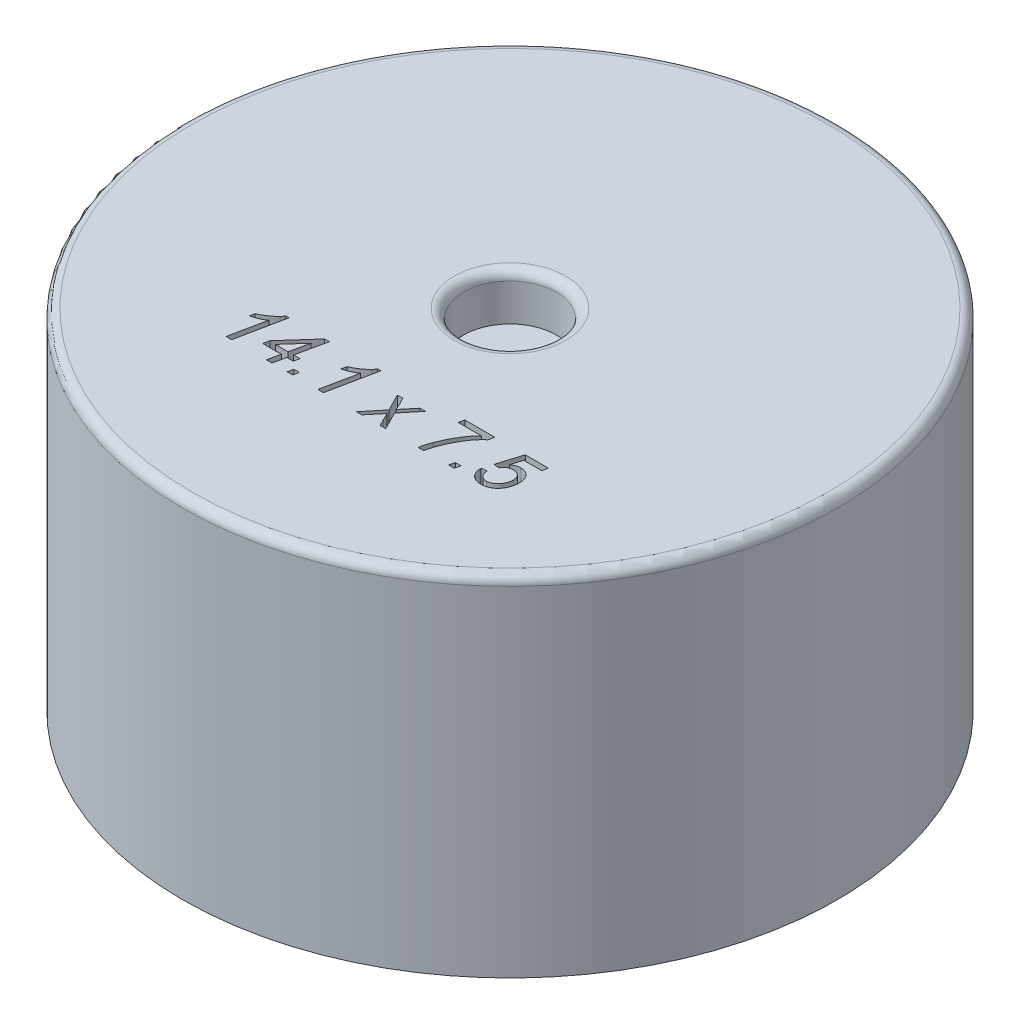
from build123d import *

# Parameters (mm, degrees)
SKETCH_1_R          = 7.05
EXTRUDE_1_DEPTH     = 7.5
FILLET_1_R          = 0.2
SKETCH_2_R          = 1
CUT_EXTRUDE_1_DEPTH = 1
FILLET_2_R          = 0.2
SKETCH_3_R          = 0.35
EXTRUDE_2_DEPTH     = 2
CUT_EXTRUDE_2_DEPTH = 0.5


with BuildPart() as part:
    # Эскиз1 → Бобышка-Вытянуть1 (new body)
    with BuildSketch(Plane(origin=(0, 0, 0), x_dir=(1, 0, 0), z_dir=(0, 1, 0))):
        with Locations(Location((0, 0, 0), (0, 0, 270))):
            Circle(SKETCH_1_R)
    extrude(amount=EXTRUDE_1_DEPTH)

    # Скругление1
    fillet_1_edges = [part.edges().sort_by_distance(p)[0] for p in [
        (0, 7.5, -7.05),
    ]]
    fillet(fillet_1_edges, radius=FILLET_1_R)

    # Эскиз2 → Вырез-Вытянуть1 (cut)
    with BuildSketch(Plane(origin=(0, 7.5, 0), x_dir=(1, 0, 0), z_dir=(0, 1, 0))):
        with Locations(Location((0, 0, 0), (0, 0, 270))):
            Circle(SKETCH_2_R)
    extrude(amount=-CUT_EXTRUDE_1_DEPTH, mode=Mode.SUBTRACT)

    # Скругление2
    fillet_2_edges = [part.edges().sort_by_distance(p)[0] for p in [
        (0, 7.5, -1),
    ]]
    fillet(fillet_2_edges, radius=FILLET_2_R)

    # Эскиз3 → Бобышка-Вытянуть2 (add)
    with BuildSketch(Plane.XZ):
        with Locations(Location((-3.81, 0, 0), (0, 0, 90))):
            Circle(SKETCH_3_R)
        with Locations(Location((3.81, 0, 0), (0, 0, 90))):
            Circle(SKETCH_3_R)
    extrude(amount=EXTRUDE_2_DEPTH)

    # Эскиз4 → Вырез-Вытянуть2 (cut)
    # profile 1 of 8: a face of its own
    with BuildSketch(Plane(origin=(0, 7.5, 0), x_dir=(1, 0, 0), z_dir=(0, 1, 0))):
        with BuildLine():
            Line((-2.53054541, -3.582039921), (-2.37249503, -2.818541337))
            add(Edge.make_bspline(
                [(-2.37249503, -2.818541337), (-2.381524562, -2.825330883), (-2.400019931, -2.839238042), (-2.430225756, -2.857966406), (-2.462854895, -2.87603836), (-2.498315854, -2.892679712), (-2.536217361, -2.908960182), (-2.577035332, -2.923470199), (-2.620233292, -2.937713904), (-2.650205363, -2.945733508), (-2.665546777, -2.949838398)],
                knots=[0, 0, 0, 0, 0.838359274, 1.717227777, 2.63582179, 3.606248445, 4.624055798, 5.697042507, 6.821215173, 8, 8, 8, 8], degree=3))
            Line((-2.665546777, -2.949838398), (-2.642086174, -2.844471478))
            add(Edge.make_bspline(
                [(-2.642086174, -2.844471478), (-2.626425815, -2.837451132), (-2.594743512, -2.823248347), (-2.548365779, -2.798322598), (-2.502054943, -2.77082324), (-2.464607337, -2.745239085), (-2.435356952, -2.724165922), (-2.414666927, -2.70884934), (-2.395435972, -2.693984165), (-2.377714065, -2.679594915), (-2.36149598, -2.66561129), (-2.346675619, -2.65223209), (-2.333174824, -2.639514077), (-2.324988745, -2.630892673), (-2.321046338, -2.626740615)],
                knots=[0, 0, 0, 0, 1.583313545, 3.203184633, 4.855583746, 6.551690609, 7.386215473, 8.182603945, 8.927160296, 9.629134756, 10.288998473, 10.903058912, 11.471714409, 12, 12, 12, 12], degree=3))
            add(Edge.make_bspline(
                [(-2.321046338, -2.626740615), (-2.316513684, -2.621587396), (-2.307221983, -2.611023567), (-2.294391783, -2.593649047), (-2.281735827, -2.574844178), (-2.273853309, -2.561545184), (-2.269803441, -2.554712447)],
                knots=[0, 0, 0, 0, 0.929584414, 1.905599249, 2.923941894, 4, 4, 4, 4], degree=3))
            Line((-2.269803441, -2.554712447), (-2.198804247, -2.554712447))
            Line((-2.198804247, -2.554712447), (-2.409949677, -3.582039921))
            Line((-2.409949677, -3.582039921), (-2.53054541, -3.582039921))
        make_face()
    # profile 2 of 8: a face of its own
    with BuildSketch(Plane(origin=(0, 7.5, 0), x_dir=(1, 0, 0), z_dir=(0, 1, 0))):
        Polygon((-1.661268317, -3.582039921), (-1.603851577, -3.31862262), (-2.003710808, -3.31862262), (-1.977369078, -3.187325559), (-1.424192746, -2.567883312), (-1.319649005, -2.567883312), (-1.457325703, -3.200084834), (-1.318825826, -3.200084834), (-1.345167556, -3.31862262), (-1.483050049, -3.31862262), (-1.540466789, -3.582039921), align=None)
        Polygon((-1.578127231, -3.200084834), (-1.489841277, -2.794257555), (-1.85224586, -3.200084834), align=None, mode=Mode.SUBTRACT)
    # profile 3 of 8: a face of its own
    with BuildSketch(Plane(origin=(0, 7.5, 0), x_dir=(1, 0, 0), z_dir=(0, 1, 0))):
        Polygon((-1.216957416, -3.582039921), (-1.187117175, -3.463502135), (-1.06857939, -3.463502135), (-1.094097941, -3.582039921), align=None)
    # profile 4 of 8: a face of its own
    with BuildSketch(Plane(origin=(0, 7.5, 0), x_dir=(1, 0, 0), z_dir=(0, 1, 0))):
        with BuildLine():
            Line((-0.554915653, -3.582039921), (-0.396865272, -2.818541337))
            add(Edge.make_bspline(
                [(-0.396865272, -2.818541337), (-0.405894805, -2.825330883), (-0.424390173, -2.839238042), (-0.454595998, -2.857966406), (-0.487225138, -2.87603836), (-0.522686096, -2.892679712), (-0.560587603, -2.908960182), (-0.601405574, -2.923470199), (-0.644603534, -2.937713904), (-0.674575606, -2.945733508), (-0.689917019, -2.949838398)],
                knots=[0, 0, 0, 0, 0.838359274, 1.717227777, 2.63582179, 3.606248445, 4.624055798, 5.697042507, 6.821215173, 8, 8, 8, 8], degree=3))
            Line((-0.689917019, -2.949838398), (-0.666456416, -2.844471478))
            add(Edge.make_bspline(
                [(-0.666456416, -2.844471478), (-0.650796057, -2.837451132), (-0.619113754, -2.823248347), (-0.572736021, -2.798322598), (-0.526425186, -2.77082324), (-0.488977579, -2.745239085), (-0.459727195, -2.724165922), (-0.439037169, -2.70884934), (-0.419806215, -2.693984165), (-0.402084307, -2.679594915), (-0.385866222, -2.66561129), (-0.371045862, -2.65223209), (-0.357545066, -2.639514077), (-0.349358987, -2.630892673), (-0.34541658, -2.626740615)],
                knots=[0, 0, 0, 0, 1.583313545, 3.203184633, 4.855583746, 6.551690609, 7.386215473, 8.182603945, 8.927160296, 9.629134756, 10.288998473, 10.903058912, 11.471714409, 12, 12, 12, 12], degree=3))
            add(Edge.make_bspline(
                [(-0.34541658, -2.626740615), (-0.340883927, -2.621587396), (-0.331592225, -2.611023567), (-0.318762025, -2.593649047), (-0.306106069, -2.574844178), (-0.298223552, -2.561545184), (-0.294173684, -2.554712447)],
                knots=[0, 0, 0, 0, 0.929584414, 1.905599249, 2.923941894, 4, 4, 4, 4], degree=3))
            Line((-0.294173684, -2.554712447), (-0.223174489, -2.554712447))
            Line((-0.223174489, -2.554712447), (-0.43431992, -3.582039921))
            Line((-0.43431992, -3.582039921), (-0.554915653, -3.582039921))
        make_face()
    # profile 5 of 8: a face of its own
    with BuildSketch(Plane(origin=(0, 7.5, 0), x_dir=(1, 0, 0), z_dir=(0, 1, 0))):
        with BuildLine():
            Line((0.274848846, -3.582039921), (0.592595965, -3.196792118))
            Line((0.592595965, -3.196792118), (0.406557496, -2.831300613))
            Line((0.406557496, -2.831300613), (0.525095281, -2.831300613))
            Line((0.525095281, -2.831300613), (0.603914677, -2.986058277))
            add(Edge.make_bspline(
                [(0.603914677, -2.986058277), (0.609818347, -2.997684684), (0.621210716, -3.020120273), (0.636463634, -3.053037017), (0.65026814, -3.083447653), (0.658174641, -3.103195461), (0.661948801, -3.112622058)],
                knots=[0, 0, 0, 0, 1.123279536, 2.167603256, 3.125307208, 4, 4, 4, 4], degree=3))
            Line((0.661948801, -3.112622058), (0.893879503, -2.831300613))
            Line((0.893879503, -2.831300613), (1.012417288, -2.831300613))
            Line((1.012417288, -2.831300613), (0.71113375, -3.196586323))
            Line((0.71113375, -3.196586323), (0.907050368, -3.582039921))
            Line((0.907050368, -3.582039921), (0.788512583, -3.582039921))
            Line((0.788512583, -3.582039921), (0.712985903, -3.433867689))
            add(Edge.make_bspline(
                [(0.712985903, -3.433867689), (0.707152069, -3.423341333), (0.694892932, -3.401221398), (0.677118792, -3.365675279), (0.657272541, -3.327097323), (0.644376206, -3.299866329), (0.637665019, -3.285695457)],
                knots=[0, 0, 0, 0, 0.868609321, 1.82528335, 2.868288479, 4, 4, 4, 4], degree=3))
            Line((0.637665019, -3.285695457), (0.393386631, -3.582039921))
            Line((0.393386631, -3.582039921), (0.274848846, -3.582039921))
        make_face()
    # profile 6 of 8: a face of its own
    with BuildSketch(Plane(origin=(0, 7.5, 0), x_dir=(1, 0, 0), z_dir=(0, 1, 0))):
        with BuildLine():
            add(Edge.make_bspline(
                [(1.605106216, -3.582039921), (1.606633628, -3.573181366), (1.609768168, -3.555001923), (1.615586254, -3.527134098), (1.622563167, -3.497961118), (1.630881628, -3.467535699), (1.640115986, -3.435739111), (1.650672517, -3.402708684), (1.662158043, -3.368229812), (1.670566491, -3.344946572), (1.674870641, -3.333028253)],
                knots=[0, 0, 0, 0, 0.833014589, 1.709504851, 2.637746519, 3.612373319, 4.632326337, 5.705963282, 6.82571917, 8, 8, 8, 8], degree=3))
            add(Edge.make_bspline(
                [(1.674870641, -3.333028253), (1.686046868, -3.303691816), (1.708594068, -3.24450775), (1.747901559, -3.157000853), (1.792217917, -3.069899022), (1.83301289, -2.998254163), (1.867479471, -2.941710413), (1.894549498, -2.900779179), (1.92210058, -2.861178715), (1.950442806, -2.823096335), (1.979749566, -2.786691803), (2.009533029, -2.751700181), (2.040009708, -2.718202511), (2.061136196, -2.696977066), (2.071642951, -2.686421097)],
                knots=[0, 0, 0, 0, 1.478146345, 2.982049598, 4.514919251, 6.078819292, 6.863350842, 7.63300255, 8.389373619, 9.134968066, 9.868028012, 10.589840564, 11.29869085, 12, 12, 12, 12], degree=3))
            Line((2.071642951, -2.686421097), (1.5703269, -2.686421097))
            Line((1.5703269, -2.686421097), (1.595228067, -2.567883312))
            Line((1.595228067, -2.567883312), (2.240188865, -2.567883312))
            Line((2.240188865, -2.567883312), (2.216522467, -2.686421097))
            add(Edge.make_bspline(
                [(2.216522467, -2.686421097), (2.202594883, -2.698895324), (2.174536016, -2.72402622), (2.134670909, -2.764751555), (2.096145872, -2.808130281), (2.058736001, -2.853948728), (2.022565365, -2.902414962), (1.988172459, -2.953752586), (1.954636869, -3.00747082), (1.933812651, -3.044756993), (1.923264925, -3.063642904)],
                knots=[0, 0, 0, 0, 0.934069845, 1.881801081, 2.845660677, 3.832314428, 4.836654525, 5.866267715, 6.919238021, 8, 8, 8, 8], degree=3))
            add(Edge.make_bspline(
                [(1.923264925, -3.063642904), (1.91147885, -3.085735502), (1.888183301, -3.129402218), (1.855803541, -3.195271503), (1.826553108, -3.26078432), (1.800239844, -3.325895922), (1.776402082, -3.39045665), (1.755940132, -3.454709028), (1.737987509, -3.518360363), (1.728397961, -3.560934202), (1.723644001, -3.582039921)],
                knots=[0, 0, 0, 0, 1.07800267, 2.130706197, 3.159265579, 4.166193198, 5.153795602, 6.121425635, 7.068708318, 8, 8, 8, 8], degree=3))
            Line((1.723644001, -3.582039921), (1.605106216, -3.582039921))
        make_face()
    # profile 7 of 8: a face of its own
    with BuildSketch(Plane(origin=(0, 7.5, 0), x_dir=(1, 0, 0), z_dir=(0, 1, 0))):
        Polygon((2.260150957, -3.582039921), (2.289991198, -3.463502135), (2.408528984, -3.463502135), (2.383010433, -3.582039921), align=None)
    # profile 8 of 8: a face of its own
    with BuildSketch(Plane(origin=(0, 7.5, 0), x_dir=(1, 0, 0), z_dir=(0, 1, 0))):
        with BuildLine():
            Line((2.672563669, -3.292280889), (2.791924634, -3.279110024))
            add(Edge.make_bspline(
                [(2.791924634, -3.279110024), (2.791697128, -3.282744695), (2.791293699, -3.289189936), (2.791031641, -3.297706718), (2.790419323, -3.303798576), (2.79046643, -3.307097499), (2.79048407, -3.308332881)],
                knots=[0, 0, 0, 0, 1.49324247, 2.647917546, 3.493671534, 4, 4, 4, 4], degree=3))
            add(Edge.make_bspline(
                [(2.79048407, -3.308332881), (2.790729153, -3.315222288), (2.791225104, -3.329163722), (2.796403765, -3.349941487), (2.803981843, -3.370849747), (2.814627749, -3.391389768), (2.827785885, -3.410772626), (2.843439575, -3.428073409), (2.861189668, -3.443090976), (2.881288953, -3.455046186), (2.902525744, -3.464761149), (2.924689927, -3.471489118), (2.94740466, -3.475836833), (2.962783037, -3.476392297), (2.970554491, -3.476673)],
                knots=[0, 0, 0, 0, 0.906627297, 1.834654978, 2.807478465, 3.834894577, 4.87595349, 5.887685388, 6.902081762, 7.928900597, 8.961082484, 9.973784094, 10.976052945, 12, 12, 12, 12], degree=3))
            add(Edge.make_bspline(
                [(2.970554491, -3.476673), (2.980890652, -3.47620171), (3.001905577, -3.475243507), (3.03328663, -3.467072478), (3.064877465, -3.454338949), (3.096352259, -3.436690187), (3.126704298, -3.414289325), (3.154261101, -3.386767275), (3.178747594, -3.354721931), (3.199437554, -3.318661352), (3.216506892, -3.280665952), (3.229038296, -3.242055102), (3.236824859, -3.203554029), (3.237807491, -3.177824862), (3.238293482, -3.165099724)],
                knots=[0, 0, 0, 0, 0.823456648, 1.674207695, 2.570467732, 3.535691777, 4.544780077, 5.570191462, 6.631860066, 7.75250498, 8.879305647, 9.948786735, 10.985510363, 12, 12, 12, 12], degree=3))
            add(Edge.make_bspline(
                [(3.238293482, -3.165099724), (3.23814496, -3.158095103), (3.237855673, -3.144451696), (3.235326897, -3.124541844), (3.23121976, -3.105734177), (3.225524501, -3.087869014), (3.21775441, -3.071228206), (3.208819276, -3.055376647), (3.197706379, -3.041011508), (3.185391049, -3.027562599), (3.171663507, -3.015485468), (3.156768935, -3.004926941), (3.140835204, -2.99600913), (3.123815335, -2.988863365), (3.105898636, -2.982950976), (3.086742956, -2.979209268), (3.066663062, -2.97661695), (3.052881161, -2.976327344), (3.045875375, -2.976180128)],
                knots=[0, 0, 0, 0, 1.106111206, 2.154452896, 3.164053986, 4.144088983, 5.109031686, 6.06061856, 7.012020331, 7.970553412, 8.937926705, 9.894006722, 10.849656805, 11.815754801, 12.806099026, 13.824039282, 14.893888794, 16, 16, 16, 16], degree=3))
            add(Edge.make_bspline(
                [(3.045875375, -2.976180128), (3.036319656, -2.976566147), (3.01741258, -2.977329928), (2.989323539, -2.982568505), (2.962254855, -2.991794788), (2.93595893, -3.003988439), (2.911485094, -3.020162747), (2.890019304, -3.041017822), (2.871419592, -3.065932598), (2.862141404, -3.084938529), (2.857367369, -3.094717914)],
                knots=[0, 0, 0, 0, 0.97081602, 1.920869877, 2.890634552, 3.869597423, 4.85931845, 5.855033763, 6.89632091, 8, 8, 8, 8], degree=3))
            Line((2.857367369, -3.094717914), (2.73780061, -3.081547049))
            Line((2.73780061, -3.081547049), (2.896468375, -2.567883312))
            Line((2.896468375, -2.567883312), (3.393051146, -2.567883312))
            Line((3.393051146, -2.567883312), (3.368561569, -2.686421097))
            Line((3.368561569, -2.686421097), (2.983313766, -2.686421097))
            Line((2.983313766, -2.686421097), (2.909433445, -2.925348821))
            add(Edge.make_bspline(
                [(2.909433445, -2.925348821), (2.916555187, -2.919950694), (2.930581981, -2.909318684), (2.952680922, -2.895617749), (2.974885823, -2.883752987), (2.997498018, -2.874237624), (3.020420935, -2.866789619), (3.043681273, -2.861401666), (3.06725918, -2.858246985), (3.083046463, -2.857843964), (3.090944429, -2.857642343)],
                knots=[0, 0, 0, 0, 1.08549606, 2.137964479, 3.156027519, 4.142328905, 5.115149779, 6.081807146, 7.040378209, 8, 8, 8, 8], degree=3))
            add(Edge.make_bspline(
                [(3.090944429, -2.857642343), (3.1004212, -2.857879015), (3.119037964, -2.858343949), (3.14631612, -2.862015745), (3.172216149, -2.868602569), (3.197010493, -2.876988322), (3.22025091, -2.888642583), (3.24243075, -2.902317055), (3.262957438, -2.919036068), (3.282394095, -2.937640699), (3.299762192, -2.958618677), (3.315185708, -2.981439205), (3.328178223, -3.006211195), (3.338580377, -3.032900813), (3.34696051, -3.061308224), (3.352521127, -3.091593556), (3.356142538, -3.123716093), (3.356597356, -3.14574456), (3.356831267, -3.157073728)],
                knots=[0, 0, 0, 0, 1.009083946, 1.982307972, 2.923133173, 3.851912484, 4.763437245, 5.685700749, 6.62123574, 7.577002532, 8.546958346, 9.51545502, 10.505559142, 11.51891788, 12.561530472, 13.654716952, 14.793828665, 16, 16, 16, 16], degree=3))
            add(Edge.make_bspline(
                [(3.356831267, -3.157073728), (3.35667418, -3.1671624), (3.356362736, -3.187164438), (3.353840154, -3.216853622), (3.349654487, -3.245888244), (3.344251605, -3.274403025), (3.336672438, -3.302159547), (3.327917121, -3.329521034), (3.317157119, -3.356121505), (3.305073499, -3.382061478), (3.291545442, -3.406884124), (3.276701589, -3.430393886), (3.260706867, -3.452475238), (3.243234243, -3.472911763), (3.22482286, -3.492113035), (3.20493052, -3.509637398), (3.183896391, -3.525740308), (3.16173405, -3.540293217), (3.138812253, -3.553169685), (3.115378341, -3.564404039), (3.091496969, -3.573824526), (3.067139428, -3.581776817), (3.04226233, -3.587635516), (3.016977534, -3.591993125), (2.991265842, -3.59479432), (2.973922932, -3.595071456), (2.965203827, -3.595210786)],
                knots=[0, 0, 0, 0, 1.107778984, 2.196308754, 3.269111178, 4.328392579, 5.380902249, 6.426704866, 7.481449709, 8.529528877, 9.567816257, 10.583531577, 11.581009243, 12.559068588, 13.533989767, 14.499905363, 15.467200609, 16.440840376, 17.408868676, 18.35231528, 19.292357287, 20.226221515, 21.16354305, 22.096099876, 23.042818958, 24, 24, 24, 24], degree=3))
            add(Edge.make_bspline(
                [(2.965203827, -3.595210786), (2.950835455, -3.594742764), (2.922734219, -3.593827421), (2.881835526, -3.586469609), (2.843424455, -3.574383536), (2.808059682, -3.557212564), (2.775905868, -3.53607186), (2.748026331, -3.510753897), (2.72404346, -3.482018857), (2.705272101, -3.449722142), (2.690683723, -3.415799515), (2.679821207, -3.381498062), (2.673115981, -3.34707879), (2.672334186, -3.32407053), (2.671946285, -3.312654571)],
                knots=[0, 0, 0, 0, 1.134559216, 2.218937215, 3.271314431, 4.306342073, 5.314938747, 6.301080251, 7.271171215, 8.260123367, 9.240754197, 10.183513153, 11.098717604, 12, 12, 12, 12], degree=3))
            add(Edge.make_bspline(
                [(2.671946285, -3.312654571), (2.672009012, -3.30984187), (2.672160502, -3.303049044), (2.672414717, -3.296259242), (2.672563669, -3.292280889)],
                knots=[0, 0, 0, 0, 0.828138796, 2, 2, 2, 2], degree=3))
        make_face()
    extrude(amount=-CUT_EXTRUDE_2_DEPTH, mode=Mode.SUBTRACT)


solid = part.part
